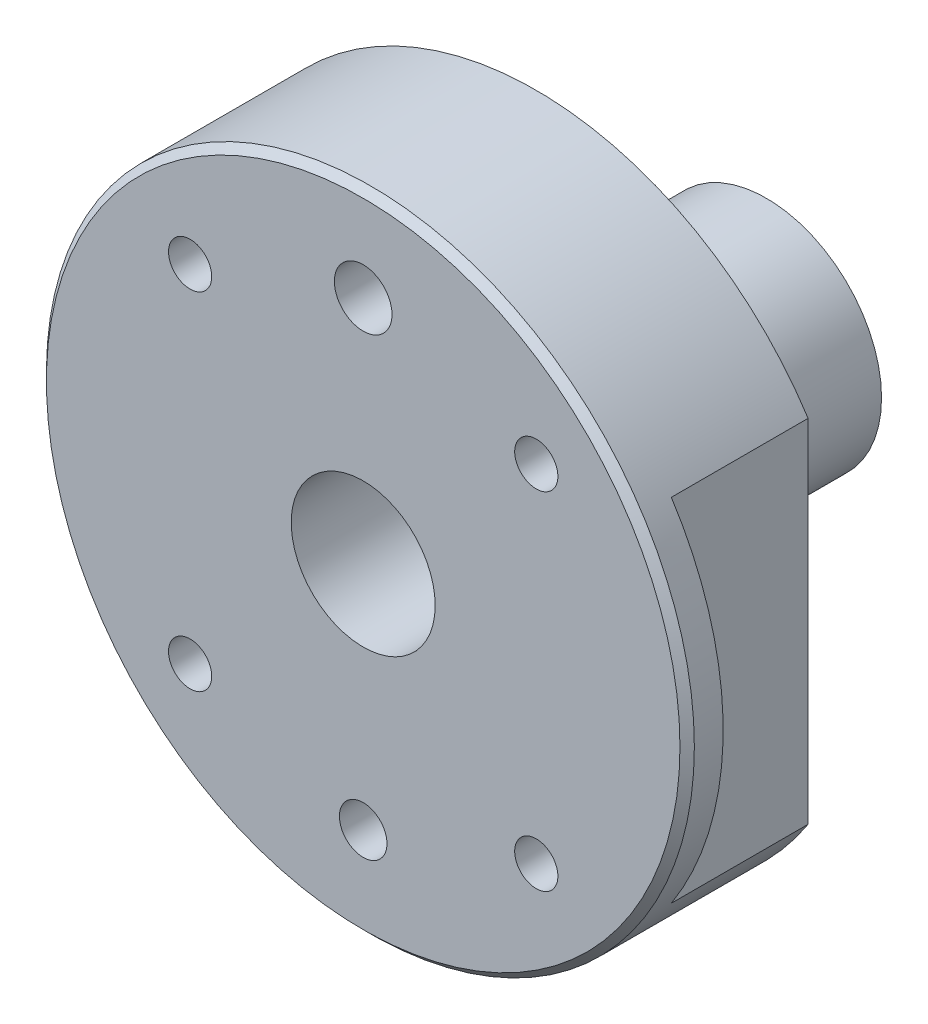
from build123d import *

# Parameters (mm, degrees)
SKETCH_1_R           = 22.5
SKETCH_1_R_2         = 5
EXTRUDE_1_DEPTH      = 12
SKETCH_2_R           = 1.5
CUT_EXTRUDE_1_DEPTH  = 5.5
CHAMFER_1_SIZE       = 0.5
SKETCH_3_OUTSIDE_W   = 59.952
SKETCH_3_OUTSIDE_H   = 59.952
SKETCH_3_OUTSIDE_W_2 = 37.8
SKETCH_3_OUTSIDE_H_2 = 50
CUT_EXTRUDE_2_DEPTH  = 9.5
SKETCH_4_R           = 8
SKETCH_4_R_2         = 4
EXTRUDE_2_DEPTH      = 16
SKETCH_5_R           = 2
SKETCH_5_R_2         = 1.65
CUT_EXTRUDE_3_DEPTH  = 16.5


with BuildPart() as part:
    # 草图1 → 凸台-拉伸1 (new body)
    with BuildSketch(Plane.XY):
        Circle(SKETCH_1_R)
        Circle(SKETCH_1_R_2, mode=Mode.SUBTRACT)
    extrude(amount=EXTRUDE_1_DEPTH)

    # 草图2 → 切除-拉伸1 (cut)
    with BuildSketch(Plane.XY.offset(12)):
        with Locations((12.02081528, 12.02081528)):
            Circle(SKETCH_2_R)
        with Locations((12.02081528, -12.02081528)):
            Circle(SKETCH_2_R)
        with Locations((-12.02081528, -12.02081528)):
            Circle(SKETCH_2_R)
        with Locations((-12.02081528, 12.02081528)):
            Circle(SKETCH_2_R)
    extrude(amount=-CUT_EXTRUDE_1_DEPTH, mode=Mode.SUBTRACT)

    # 倒角1
    chamfer_1_edges = [part.edges().sort_by_distance(p)[0] for p in [
        (-22.5, 0, 12),
    ]]
    chamfer(chamfer_1_edges, length=CHAMFER_1_SIZE)

    # 草图3 outside → 切除-拉伸2 (cut)
    with BuildSketch(Plane(origin=(0, 0, 0), x_dir=(-1, 0, 0), z_dir=(0, 0, -1))):
        Rectangle(SKETCH_3_OUTSIDE_W, SKETCH_3_OUTSIDE_H)
        Rectangle(SKETCH_3_OUTSIDE_W_2, SKETCH_3_OUTSIDE_H_2, mode=Mode.SUBTRACT)
    extrude(amount=-CUT_EXTRUDE_2_DEPTH, mode=Mode.SUBTRACT)

    # 草图4 → 凸台-拉伸2 (add)
    with BuildSketch(Plane(origin=(0, 0, 0), x_dir=(-1, 0, 0), z_dir=(0, 0, -1))):
        with Locations(Location((0, 0, 0), (0, 0, 180))):
            Circle(SKETCH_4_R)
        Circle(SKETCH_4_R_2, mode=Mode.SUBTRACT)
    extrude(amount=EXTRUDE_2_DEPTH)

    # 草图5 → 切除-拉伸3 (cut)
    with BuildSketch(Plane(origin=(0, 0, 0), x_dir=(-1, 0, 0), z_dir=(0, 0, -1))):
        with Locations((0, 16)):
            Circle(SKETCH_5_R)
        with Locations((0, -16)):
            Circle(SKETCH_5_R_2)
    extrude(amount=-CUT_EXTRUDE_3_DEPTH, mode=Mode.SUBTRACT)


solid = part.part
